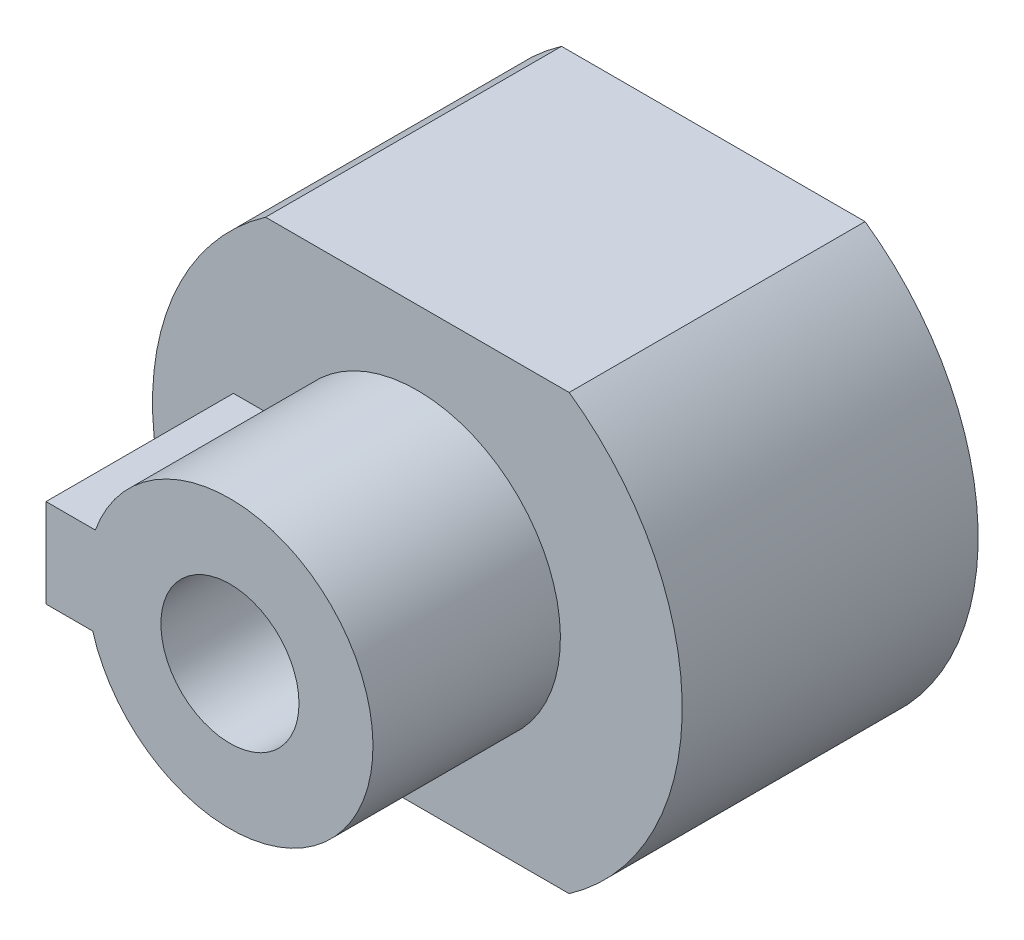
from build123d import *

# Parameters (mm, degrees)
BOSS_EXTRUDE1_DEPTH = 6
BOSS_EXTRUDE2_DEPTH = 3.8
SKETCH3_R           = 1.4
CUT_EXTRUDE1_DEPTH  = 13.009524001


with BuildPart() as part:
    # Sketch1 → Boss-Extrude1 (new body)
    with BuildSketch(Plane(origin=(0, 0, 0), x_dir=(0, 1, 0), z_dir=(0, 0, 1))):
        with BuildLine():
            Line((-4.4, -3.077119877), (-4.4, 3.077119877))
            ThreePointArc((-4.4, 3.077119877), (0, 5.369233347), (4.4, 3.077119877))
            Line((4.4, 3.077119877), (4.4, -3.077119877))
            ThreePointArc((4.4, -3.077119877), (0, -5.369233347), (-4.4, -3.077119877))
        make_face()
        with BuildLine():
            ThreePointArc((-1.9, -2.15), (0, -2.869233347), (1.9, -2.15))
            Line((1.9, -2.15), (1.9, 2.15))
            ThreePointArc((1.9, 2.15), (0, 2.869233347), (-1.9, 2.15))
            Line((-1.9, 2.15), (-1.9, -2.15))
        make_face(mode=Mode.SUBTRACT)
    extrude(amount=BOSS_EXTRUDE1_DEPTH)

    # Sketch2 → Boss-Extrude2 (add)
    with BuildSketch(Plane.XY.offset(6)):
        with BuildLine():
            Line((-3.728872107, -0.818543418), (-3.728872107, 0.981456582))
            Line((-3.728872107, 0.981456582), (-2.728872107, 0.981456582))
            ThreePointArc((-2.728872107, 0.981456582), (2.898733684, -0.085691473), (-2.782083153, -0.818543418))
            Line((-2.782083153, -0.818543418), (-3.728872107, -0.818543418))
        make_face()
    extrude(amount=BOSS_EXTRUDE2_DEPTH)

    # Sketch3 → Cut-Extrude1 (cut, through all)
    with BuildSketch(Plane.XY.offset(9.8)):
        Circle(SKETCH3_R)
    extrude(amount=-CUT_EXTRUDE1_DEPTH, mode=Mode.SUBTRACT)


solid = part.part
